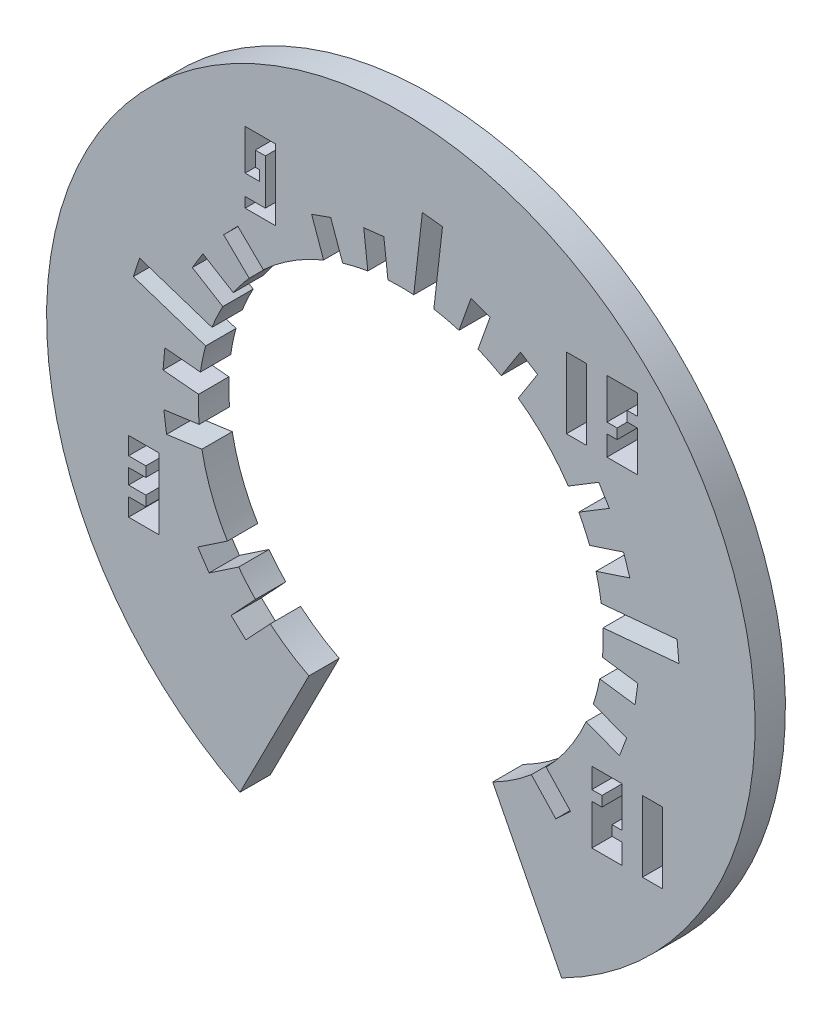
from build123d import *

# Parameters (mm, degrees)
BOSS_EXTRUDE1_DEPTH = 1.5
SKETCH3_W           = 1
SKETCH3_H           = 3.5
CUT_EXTRUDE2_DEPTH  = 1.5


with BuildPart() as part:
    # Sketch1 → Boss-Extrude1 (new body)
    with BuildSketch(Plane.XY):
        with BuildLine():
            Line((-4.539904997, -8.910065242), (-7.944833745, -15.592614173))
            ThreePointArc((-7.944833745, -15.592614173), (0, 17.5), (7.944833745, -15.592614173))
            Line((7.944833745, -15.592614173), (4.539904997, -8.910065242))
            ThreePointArc((4.539904997, -8.910065242), (0, 10), (-4.539904997, -8.910065242))
        make_face()
    extrude(amount=BOSS_EXTRUDE1_DEPTH)

    # Sketch3 → Cut-Extrude2 (cut)
    with BuildSketch(Plane.XY.offset(1.5)):
        Polygon((-13.448841764, -3.075278615), (-11.948841764, -3.075278615), (-11.948841764, -6.575278615), (-13.448841764, -6.575278615), (-13.448841764, -5.700278615), (-12.594138864, -5.700278615), (-12.594138864, -5.200278615), (-13.448841764, -5.200278615), (-13.448841764, -4.450278615), (-12.594138864, -4.450278615), (-12.594138864, -3.950278615), (-13.448841764, -3.950278615), align=None)
        Polygon((-6.189760479, 13.023085903), (-6.189760479, 9.523085903), (-7.689760479, 9.523085903), (-7.689760479, 10.023085903), (-6.689760479, 10.023085903), (-6.689760479, 10.523085903), (-6.689760479, 12.259445402), (-7.189760479, 12.259445402), (-7.189760479, 11.523085903), (-6.989760479, 11.523085903), (-6.989760479, 11.023085903), (-7.189760479, 11.023085903), (-7.689760479, 11.023085903), (-7.689760479, 13.023085903), align=None)
        with Locations((8.681961549, 9.557519934)):
            Rectangle(SKETCH3_W, SKETCH3_H)
        Polygon((10.181961549, 11.307519934), (10.181961549, 9.307519934), (10.681961549, 9.307519934), (10.681961549, 8.807519934), (10.181961549, 8.807519934), (10.181961549, 7.807519934), (11.681961549, 7.807519934), (11.681961549, 9.807519934), (11.181961549, 9.807519934), (11.181961549, 10.307519934), (11.681961549, 10.307519934), (11.681961549, 11.307519934), align=None)
        with Locations((12.435856983, -7.53707486)):
            Rectangle(SKETCH3_W, SKETCH3_H)
        Polygon((9.435856983, -5.78707486), (10.935856983, -5.78707486), (10.935856983, -7.78707486), (10.435856983, -7.78707486), (10.435856983, -8.28707486), (10.935856983, -8.28707486), (10.935856983, -9.28707486), (9.435856983, -9.28707486), (9.435856983, -7.285099387), (9.935856983, -7.285099387), (9.935856983, -6.78707486), (9.435856983, -6.78707486), align=None)
        Polygon((-9.472185157, -6.970667712), (-10.030119205, -6.14078242), (-7.540463329, -4.466980276), (-6.982529281, -5.296865568), align=None)
        Polygon((-5.606922021, -6.736091259), (-6.337757985, -6.053538116), (-8.385417415, -8.246046009), (-7.654581451, -8.928599152), align=None)
        Polygon((-11.001594478, 4.156611473), (-12.900873876, 4.783299409), (-13.214217844, 3.83365971), (-11.314938446, 3.206971774), (-8.466019349, 2.26693987), (-8.152675381, 3.216579569), align=None)
        Polygon((1.831331602, 11.617173691), (2.058491975, 13.604231356), (1.064963142, 13.717811542), (0.83780277, 11.730753877), (0.497062212, 8.750167379), (1.490591044, 8.636587193), align=None)
        Polygon((-11.572476541, -2.0953011), (-11.70864319, -1.104615154), (-8.736585352, -0.696115207), (-8.600418703, -1.686801153), align=None)
        Polygon((-11.746785331, 0.570556211), (-11.655850469, 1.566413053), (-8.668279941, 1.293608466), (-8.759214803, 0.297751624), align=None)
        Polygon((-10.299219978, 5.677901711), (-9.779636028, 6.532321115), (-7.216377815, 4.973569265), (-7.735961765, 4.119149861), align=None)
        Polygon((-8.752042864, 7.855841502), (-8.053030417, 8.570951003), (-5.907701913, 6.473913662), (-6.60671436, 5.758804161), align=None)
        Polygon((11.746785331, 0.570556211), (13.738499016, 0.752425935), (13.647564154, 1.748282778), (11.655850469, 1.566413053), (8.668279941, 1.293608466), (8.759214803, 0.297751624), align=None)
        Polygon((-4.405965904, 10.904126029), (-3.463704982, 11.239005641), (-2.459066145, 8.412222875), (-3.401327068, 8.077343262), align=None)
        Polygon((-1.831331602, 11.617173691), (-0.83780277, 11.730753877), (-0.497062212, 8.750167379), (-1.490591044, 8.636587193), align=None)
        Polygon((3.463704982, 11.239005641), (4.405965904, 10.904126029), (3.401327068, 8.077343262), (2.459066145, 8.412222875), align=None)
        Polygon((5.910873662, 10.167304094), (6.753244282, 9.628405458), (5.136548374, 7.101293601), (4.294177755, 7.640192237), align=None)
        Polygon((9.779636028, 6.532321115), (10.299219978, 5.677901711), (7.735961765, 4.119149861), (7.216377815, 4.973569265), align=None)
        Polygon((11.001594478, 4.156611473), (11.314938446, 3.206971774), (8.466019349, 2.26693987), (8.152675381, 3.216579569), align=None)
        Polygon((11.70864319, -1.104615154), (11.572476541, -2.0953011), (8.600418703, -1.686801153), (8.736585352, -0.696115207), align=None)
        Polygon((11.157248442, -3.718643193), (10.801006731, -4.65303703), (7.997825219, -3.584311895), (8.354066931, -2.649918058), align=None)
        Polygon((8.385417415, -8.246046009), (7.654581451, -8.928599152), (5.606922021, -6.736091259), (6.337757985, -6.053538116), align=None)
    extrude(amount=-CUT_EXTRUDE2_DEPTH, mode=Mode.SUBTRACT)


solid = part.part
